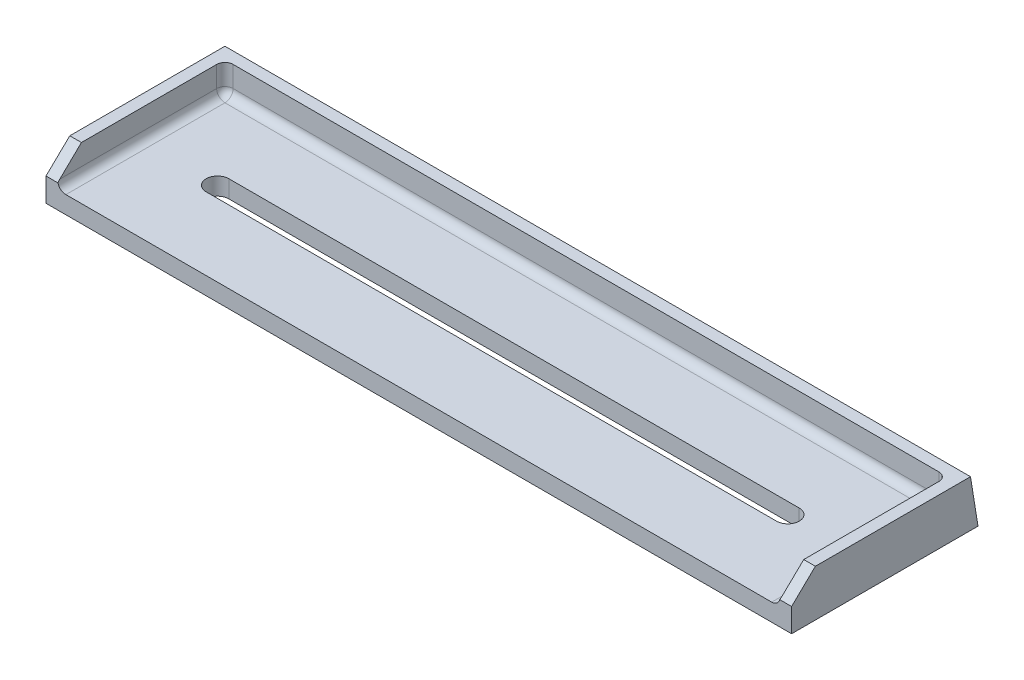
from build123d import *

# Parameters (mm, degrees)
SKETCH1_W           = 101.6
SKETCH1_H           = 25.4
BOSS_EXTRUDE1_DEPTH = 6.35
CUT_EXTRUDE2_DEPTH  = 101.6
SKETCH4_W           = 98.425
SKETCH4_H           = 22.79142
CUT_EXTRUDE3_DEPTH  = 3.96748
CUT_EXTRUDE6_DEPTH  = 2.54
CUT_EXTRUDE7_DEPTH  = 1.5875
CUT_EXTRUDE8_DEPTH  = 1.5875
FILLET1_R           = 1.12268


with BuildPart() as part:
    # Sketch1 → Boss-Extrude1 (new body)
    with BuildSketch(Plane(origin=(0, 0, 0), x_dir=(1, 0, 0), z_dir=(0, 1, 0))):
        Rectangle(SKETCH1_W, SKETCH1_H)
    extrude(amount=BOSS_EXTRUDE1_DEPTH)

    # Sketch2 → Cut-Extrude2 (cut)
    with BuildSketch(Plane.ZY.offset(50.8)):
        Polygon((-12.7, 0), (-11.67892, 6.35), (-12.7, 6.35), align=None)
    extrude(amount=-CUT_EXTRUDE2_DEPTH, mode=Mode.SUBTRACT)

    # Sketch4 → Cut-Extrude3 (cut)
    with BuildSketch(Plane(origin=(0, 6.35, 0), x_dir=(1, 0, 0), z_dir=(0, 1, 0))):
        with Locations((0, -1.30429)):
            Rectangle(SKETCH4_W, SKETCH4_H)
    extrude(amount=-CUT_EXTRUDE3_DEPTH, mode=Mode.SUBTRACT)

    # Sketch5 → Cut-Extrude6 (cut)
    with BuildSketch(Plane(origin=(0, 2.38252, 0), x_dir=(1, 0, 0), z_dir=(0, 1, 0))):
        with BuildLine():
            Line((-38.862, -2.818654725), (38.862, -2.818654725))
            ThreePointArc((38.862, -2.818654725), (40.410654725, -1.27), (38.862, 0.278654725))
            Line((38.862, 0.278654725), (-38.862, 0.278654725))
            ThreePointArc((-38.862, 0.278654725), (-40.410654725, -1.27), (-38.862, -2.818654725))
        make_face()
    extrude(amount=-CUT_EXTRUDE6_DEPTH, mode=Mode.SUBTRACT)

    # Sketch6 → Cut-Extrude7 (cut)
    with BuildSketch(Plane(origin=(-49.2125, 0, 0), x_dir=(0, 0, -1), z_dir=(1, 0, 0))):
        Polygon((-9.45896, 6.35), (-12.7, 3.22326), (-12.7, 6.35), align=None)
    extrude(amount=-CUT_EXTRUDE7_DEPTH, mode=Mode.SUBTRACT)

    # Sketch7 → Cut-Extrude8 (cut)
    with BuildSketch(Plane.ZY.offset(-49.2125)):
        Polygon((9.45896, 6.35), (12.7, 3.22326), (12.7, 6.35), align=None)
    extrude(amount=-CUT_EXTRUDE8_DEPTH, mode=Mode.SUBTRACT)

    # Fillet1
    fillet1_edges = [part.edges().sort_by_distance(p)[0] for p in [
        (49.2125, 4.36626, -10.09142),
        (49.2125, 2.38252, 1.30429),
        (-49.2125, 4.36626, -10.09142),
        (-49.2125, 2.38252, 1.30429),
        (0, 2.38252, -10.09142),
    ]]
    fillet(fillet1_edges, radius=FILLET1_R)


solid = part.part
